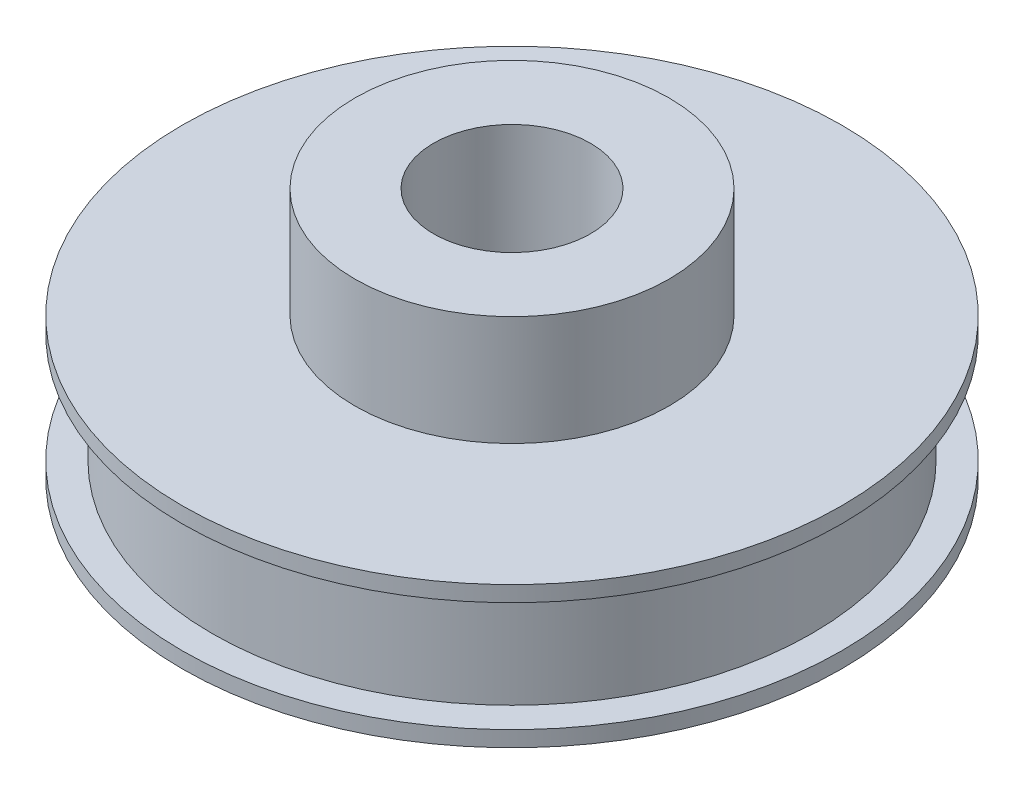
from build123d import *


with BuildPart() as part:
    # Sketch1 → Revolve1 (revolve)
    with BuildSketch(Plane.XY, mode=Mode.PRIVATE) as revolve1_sk:
        Polygon((5, 16), (10, 16), (10, 9), (21, 9), (21, 8), (19.1, 8), (19.1, 1), (21, 1), (21, 0), (5, 0), align=None)
    revolve(revolve1_sk.sketch.rotate(Axis((0, 0, 0), (0, 1, 0)), 90), axis=Axis((0, 0, 0), (0, 1, 0)))


solid = part.part
